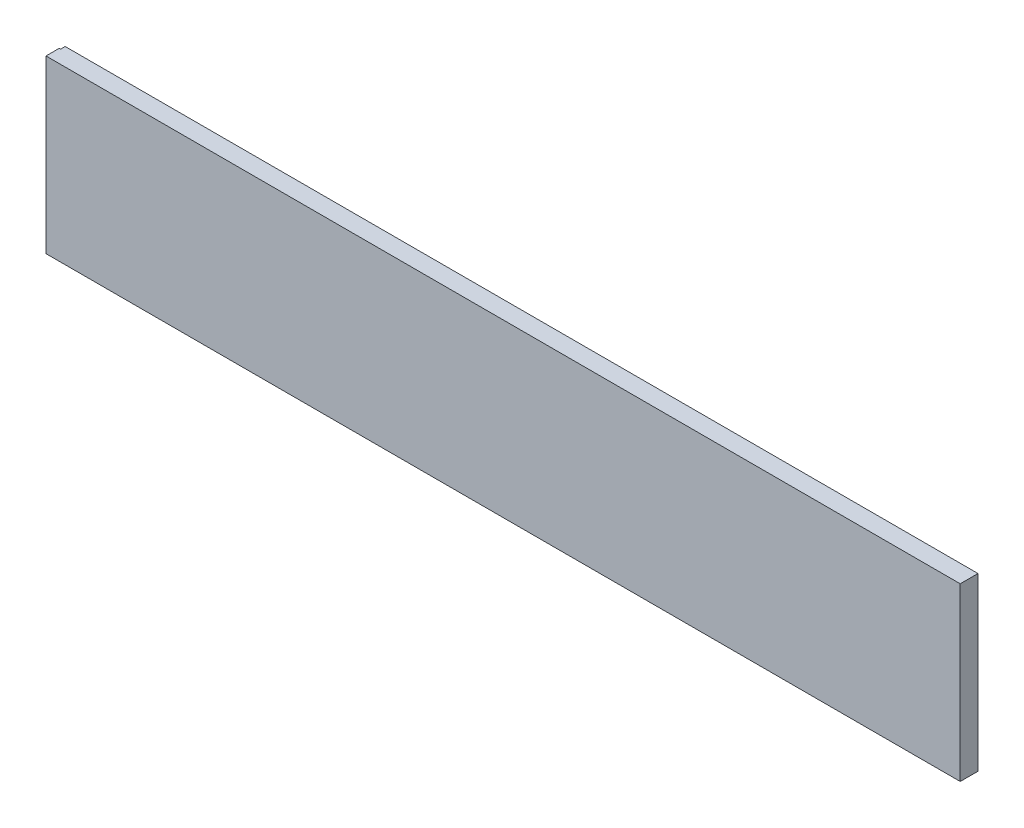
from build123d import *

# Parameters (mm, degrees)
SKETCH1_R           = 36
SKETCH1_R_2         = 20.52
BOSS_EXTRUDE1_DEPTH = 20
SKETCH2_W           = 2056.908092605
SKETCH2_H           = 385.28
BOSS_EXTRUDE2_DEPTH = 10
BOSS_EXTRUDE3_START = 30
SKETCH3_R           = 36
BOSS_EXTRUDE3_DEPTH = 30
SKETCH4_W           = 2013.042913478
SKETCH4_H           = 345.28
BOSS_EXTRUDE4_DEPTH = 10


with BuildPart() as part:
    # Sketch1 → Boss-Extrude1 (new body)
    with BuildSketch(Plane.XY):
        Polygon((-406.4, -152.64), (406.4, -152.64), (1650.508092605, -152.64), (1650.508092605, 232.64), (-406.4, 232.64), (-406.4, 152.64), align=None)
        Circle(SKETCH1_R, mode=Mode.SUBTRACT)
        with Locations((0, 95.04)):
            Circle(SKETCH1_R_2, mode=Mode.SUBTRACT)
        with Locations((0, -95.04)):
            Circle(SKETCH1_R_2, mode=Mode.SUBTRACT)
    extrude(amount=BOSS_EXTRUDE1_DEPTH)

    # Sketch2 → Boss-Extrude2 (add)
    with BuildSketch(Plane.XY.offset(20)):
        with Locations((622.054046302, 40)):
            Rectangle(SKETCH2_W, SKETCH2_H)
    extrude(amount=BOSS_EXTRUDE2_DEPTH)

    # Sketch3 → Boss-Extrude3 (add)
    with BuildSketch(Plane(origin=(0, 0, 20), x_dir=(-1, 0, 0), z_dir=(0, 0, -1)).offset(BOSS_EXTRUDE3_START)):
        with Locations(Location((0, 0, 0), (0, 0, 180))):
            Circle(SKETCH3_R)
    extrude(amount=-BOSS_EXTRUDE3_DEPTH)

    # Sketch4 → Boss-Extrude4 (add)
    with BuildSketch(Plane(origin=(0, 0, 0), x_dir=(-1, 0, 0), z_dir=(0, 0, -1))):
        Polygon((-1630.508092605, 232.64), (-1650.508092605, 232.64), (-1650.508092605, -152.64), (403.233696812, -152.64), (403.233696812, 232.64), align=None)
        with Locations((-623.986635866, 40)):
            Rectangle(SKETCH4_W, SKETCH4_H, mode=Mode.SUBTRACT)
    extrude(amount=BOSS_EXTRUDE4_DEPTH)


solid = part.part
